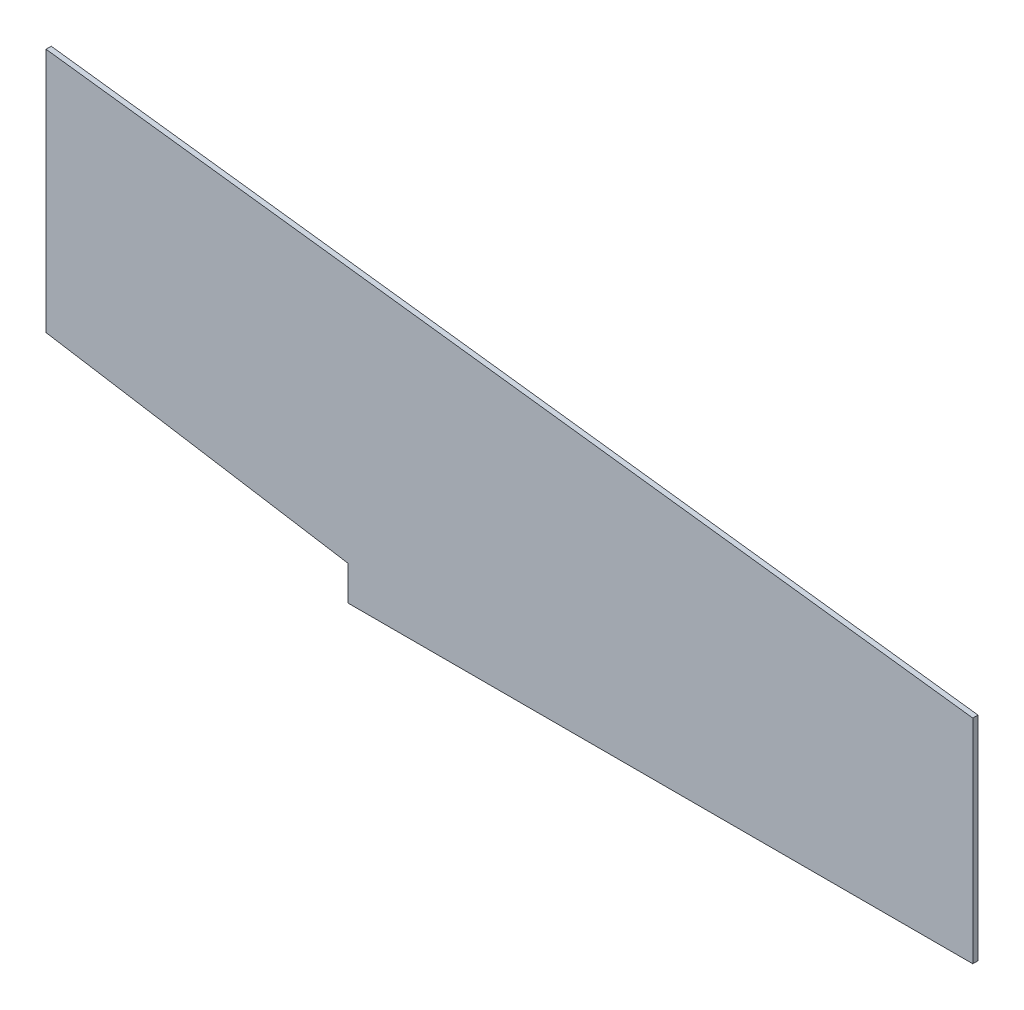
from build123d import *

# Parameters (mm, degrees)
BOSS_EXTRUDE1_DEPTH = 2


with BuildPart() as part:
    # Sketch1 → Boss-Extrude1 (new body)
    with BuildSketch(Plane.XY):
        Polygon((172.285714286, 133.234435563), (172.285714286, 51.491616474), (-67.714285714, 51.491616474), (-67.714285714, 64.731173228), (-183.714285714, 83.465897748), (-183.714285714, 177.734435563), align=None)
    extrude(amount=BOSS_EXTRUDE1_DEPTH)


solid = part.part
